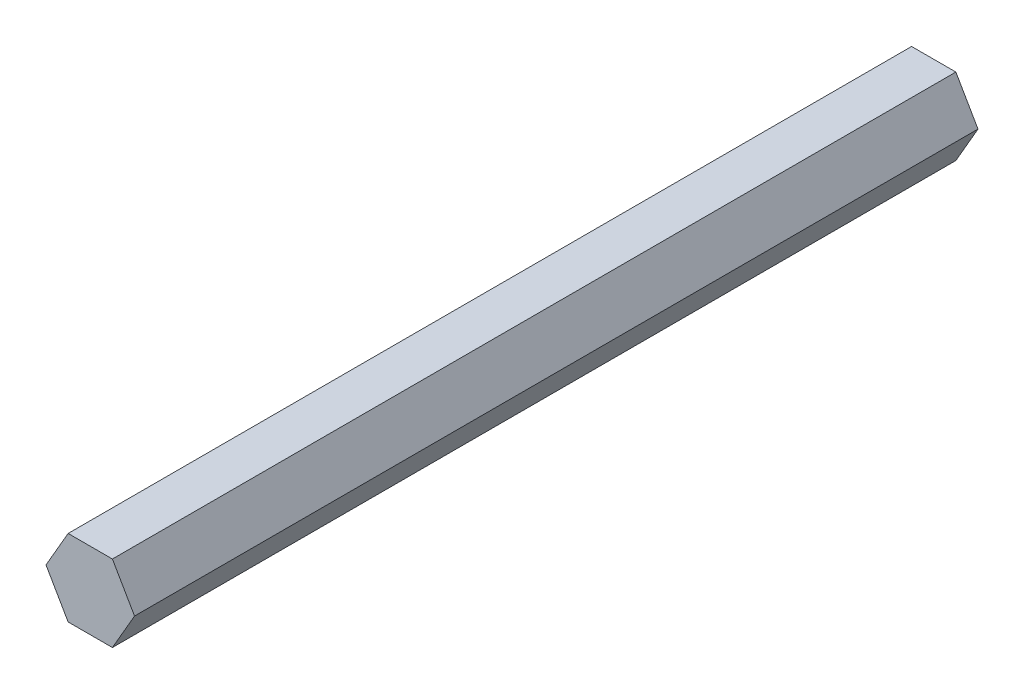
from build123d import *

# Parameters (mm, degrees)
BOSS_EXTRUDE1_DEPTH = 55


with BuildPart() as part:
    # Sketch1 → Boss-Extrude1 (new body)
    with BuildSketch(Plane.XY):
        Polygon((1.443375673, -2.5), (2.886751346, 0), (1.443375673, 2.5), (-1.443375673, 2.5), (-2.886751346, 0), (-1.443375673, -2.5), align=None)
    extrude(amount=BOSS_EXTRUDE1_DEPTH)


solid = part.part
